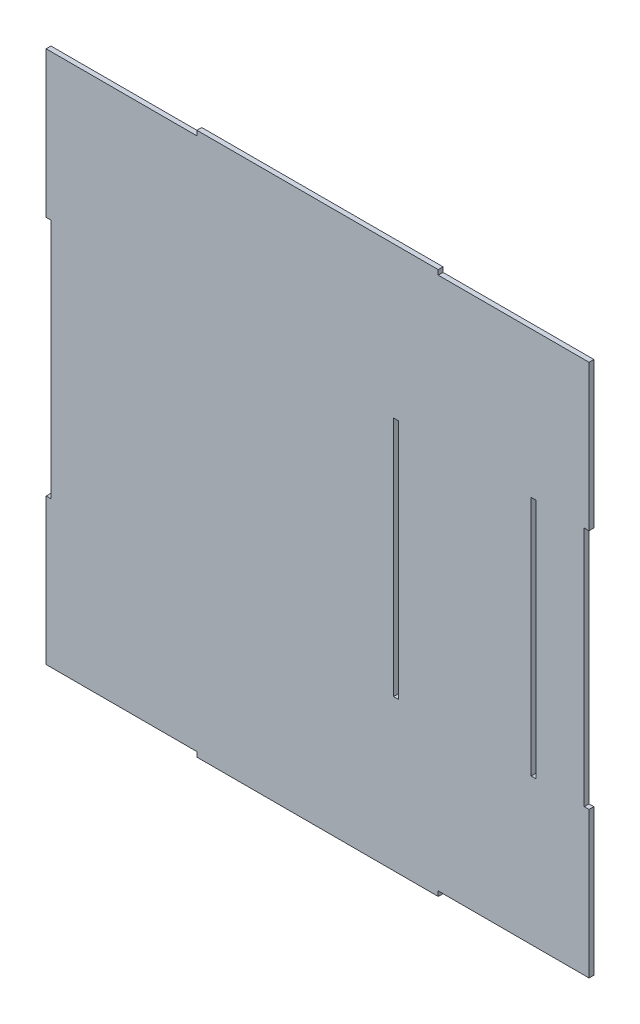
from build123d import *

# Parameters (mm, degrees)
SKETCH1_W           = 4
SKETCH1_H           = 200
BOSS_EXTRUDE1_DEPTH = 4


with BuildPart() as part:
    # Sketch1 → Boss-Extrude1 (new body)
    with BuildSketch(Plane.XY):
        Polygon((-248.954185923, -107.533108544), (-252.954185923, -107.533108544), (-252.954185923, -228.533108544), (-127.954185923, -228.533108544), (-127.954185923, -232.533108544), (72.045814077, -232.533108544), (72.045814077, -228.533108544), (197.045814077, -228.533108544), (197.045814077, -107.533108544), (193.045814077, -107.533108544), (193.045814077, 92.466891456), (197.045814077, 92.466891456), (197.045814077, 213.466891456), (72.045814077, 213.466891456), (72.045814077, 217.466891456), (-127.954185923, 217.466891456), (-127.954185923, 213.466891456), (-252.954185923, 213.466891456), (-252.954185923, 92.466891456), (-248.954185923, 92.466891456), align=None)
        with Locations((37.045814077, -7.533108544)):
            Rectangle(SKETCH1_W, SKETCH1_H, mode=Mode.SUBTRACT)
        with Locations((151.045814077, -7.533108544)):
            Rectangle(SKETCH1_W, SKETCH1_H, mode=Mode.SUBTRACT)
    extrude(amount=BOSS_EXTRUDE1_DEPTH)


solid = part.part
